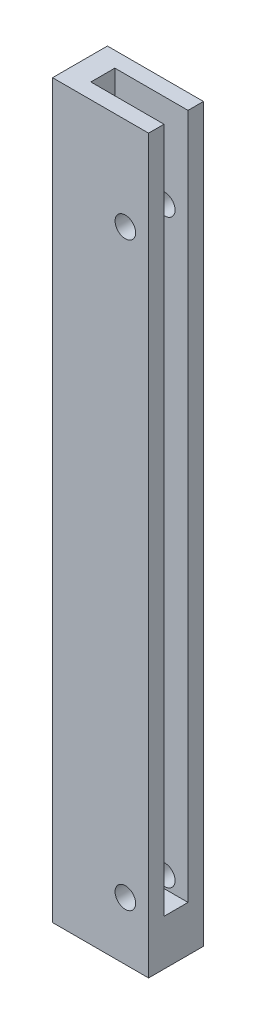
from build123d import *

# Parameters (mm, degrees)
SKETCH1_W           = 21
SKETCH1_H           = 160
SKETCH1_R           = 2.2479
BOSS_EXTRUDE1_DEPTH = 12
SKETCH2_W           = 5.25
SKETCH2_H           = 150
CUT_EXTRUDE1_DEPTH  = 16


with BuildPart() as part:
    # Sketch1 → Boss-Extrude1 (new body)
    with BuildSketch(Plane.XY):
        with Locations((10.5, 80)):
            Rectangle(SKETCH1_W, SKETCH1_H)
        with Locations((15.92, 12.7)):
            Circle(SKETCH1_R, mode=Mode.SUBTRACT)
        with Locations((15.92, 139.7)):
            Circle(SKETCH1_R, mode=Mode.SUBTRACT)
    extrude(amount=BOSS_EXTRUDE1_DEPTH)

    # Sketch2 → Cut-Extrude1 (cut)
    with BuildSketch(Plane(origin=(21, 0, 0), x_dir=(0, 0, -1), z_dir=(1, 0, 0))):
        with Locations((-6, 85)):
            Rectangle(SKETCH2_W, SKETCH2_H)
    extrude(amount=-CUT_EXTRUDE1_DEPTH, mode=Mode.SUBTRACT)


solid = part.part
